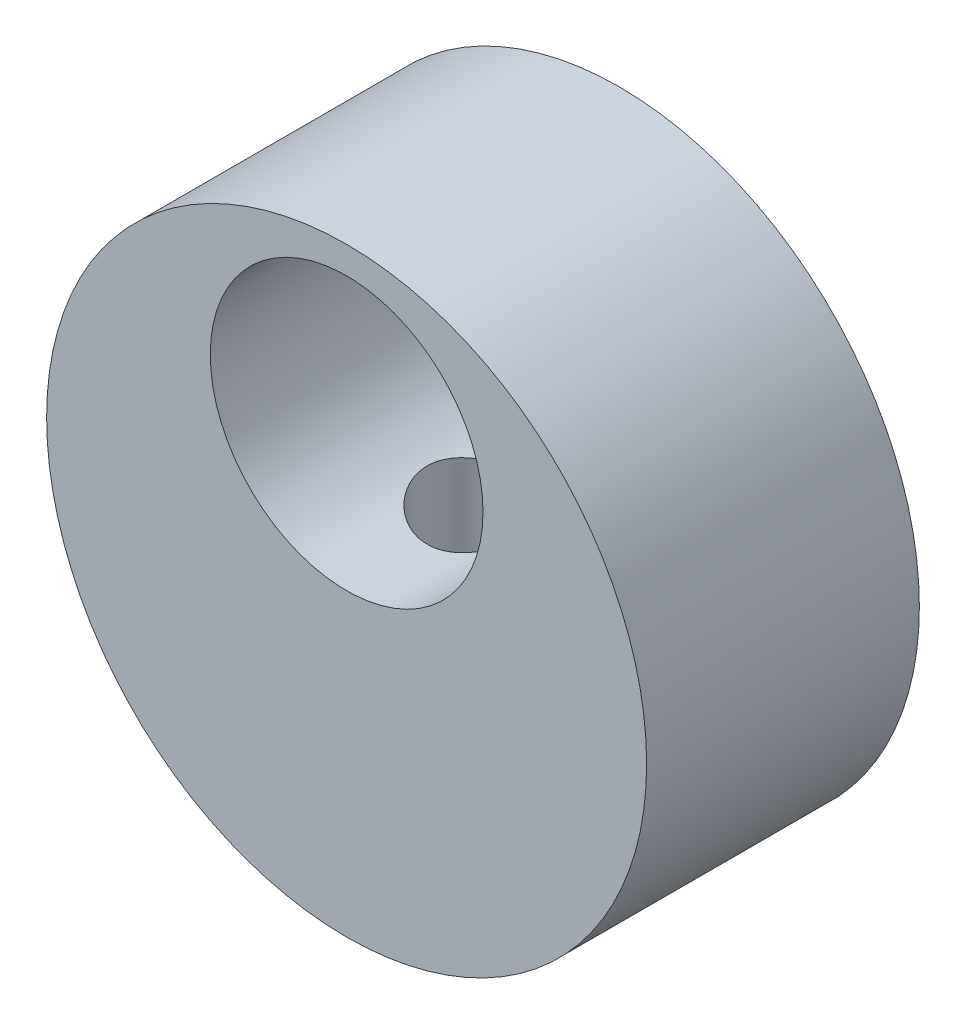
from build123d import *

# Parameters (mm, degrees)
SKETCH1_R               = 5.5
BOSS_EXTRUDE1_DEPTH     = 5
SKETCH4_R               = 2.5
CUT_EXTRUDE1_DEPTH      = 10.246621004
M2_5_TAPPED_HOLE2_D     = 2.05
M2_5_TAPPED_HOLE2_DEPTH = 8


with BuildPart() as part:
    # Sketch1 → Boss-Extrude1 (new body)
    with BuildSketch(Plane.XY):
        Circle(SKETCH1_R)
    extrude(amount=BOSS_EXTRUDE1_DEPTH)

    # Sketch4 → Cut-Extrude1 (cut, through all)
    with BuildSketch(Plane(origin=(0, 0, 0), x_dir=(-1, 0, 0), z_dir=(0, 0, -1))):
        with Locations((0, 2.5)):
            Circle(SKETCH4_R)
    extrude(amount=-CUT_EXTRUDE1_DEPTH, mode=Mode.SUBTRACT)

    # M2.5 Tapped Hole2
    with Locations(Plane(origin=(0, -5.5, 2.5), x_dir=(-1, 0, 0), z_dir=(0, -1, 0))):
        with Locations((0, 0)):
            Hole(M2_5_TAPPED_HOLE2_D / 2, depth=M2_5_TAPPED_HOLE2_DEPTH)


solid = part.part
